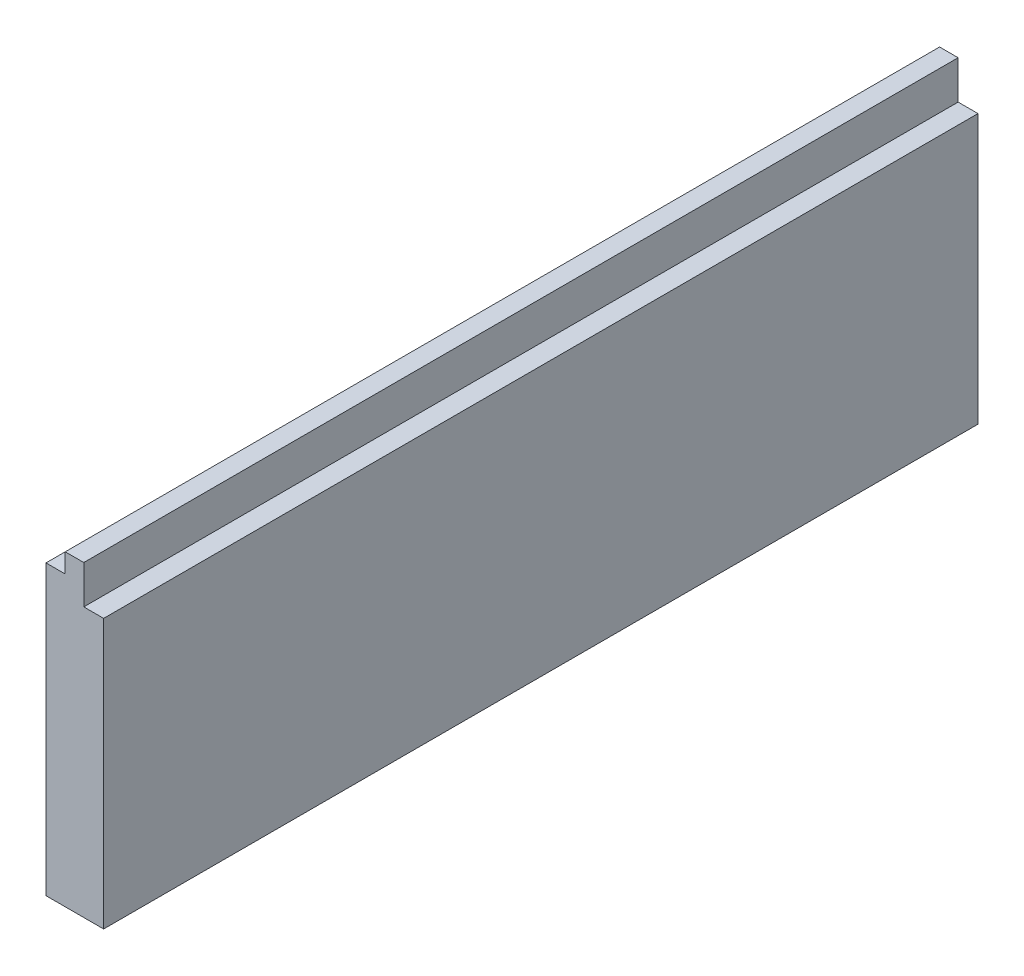
from build123d import *

# Parameters (mm, degrees)
EXTRUDE_1_DEPTH = 455


with BuildPart() as part:
    # Эскиз1 → Бобышка-Вытянуть1 (new body)
    with BuildSketch(Plane.XY):
        Polygon((0, 0), (10, 0), (30, 0), (30, 140), (19.661947875, 140), (19.661947875, 160), (10, 160), (10, 150), (0, 150), align=None)
    extrude(amount=EXTRUDE_1_DEPTH)


solid = part.part
